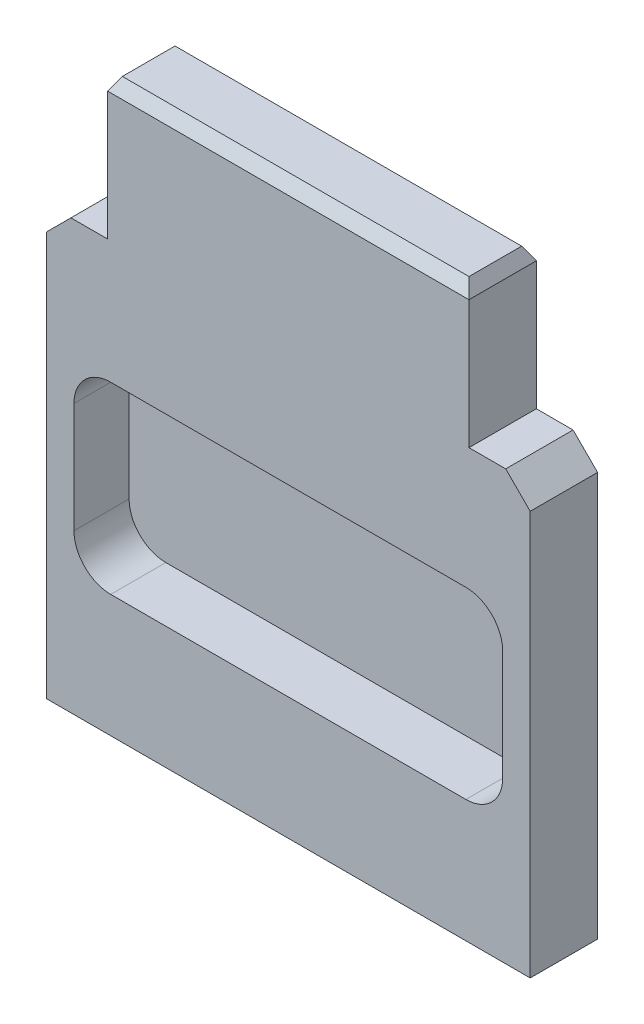
from build123d import *

# Parameters (mm, degrees)
EXTRUDE_1_DEPTH     = 5.5
CHAMFER_1_SIZE      = 0.6
CHAMFER_1_SIZE2     = 1.039230485
SKETCH_2_W          = 35
SKETCH_2_H          = 15
CUT_EXTRUDE_1_DEPTH = 4.5
FILLET_1_R          = 3
SKETCH_3_R          = 1
EXTRUDE_2_DEPTH     = 1.5


with BuildPart() as part:
    # Эскиз1 → Бобышка-Вытянуть1 (new body)
    with BuildSketch(Plane.XY):
        Polygon((19.75, 0), (-19.75, 0), (-19.75, 33), (-17.75, 35), (-14.75, 35), (-14.75, 46.5), (14.75, 46.5), (14.75, 35), (17.75, 35), (19.75, 33), align=None)
    extrude(amount=EXTRUDE_1_DEPTH)

    # Фаска1
    chamfer_1_edges = [part.edges().sort_by_distance(p)[0] for p in [
        (0, 46.5, 0),
        (-14.75, 46.5, 2.75),
        (14.75, 46.5, 2.75),
        (0, 46.5, 5.5),
    ]]
    chamfer_1_side = [part.faces().sort_by_distance(p)[0] for p in [
        (0, 46.5, 2.75),
    ]]
    chamfer(chamfer_1_edges, length=CHAMFER_1_SIZE, length2=CHAMFER_1_SIZE2, reference=chamfer_1_side[0])

    # Эскиз2 → Вырез-Вытянуть1 (cut)
    with BuildSketch(Plane.XY.offset(5.5)):
        with Locations((0, 17.5)):
            Rectangle(SKETCH_2_W, SKETCH_2_H)
    extrude(amount=-CUT_EXTRUDE_1_DEPTH, mode=Mode.SUBTRACT)

    # Скругление1
    fillet_1_edges = [part.edges().sort_by_distance(p)[0] for p in [
        (17.5, 10, 3.25),
        (17.5, 25, 3.25),
        (-17.5, 25, 3.25),
        (-17.5, 10, 3.25),
    ]]
    fillet(fillet_1_edges, radius=FILLET_1_R)

    # Эскиз3 → Бобышка-Вытянуть2 (add)
    with BuildSketch(Plane.XZ):
        with Locations(Location((0, 2.5, 0), (0, 0, 90))):
            Circle(SKETCH_3_R)
    extrude(amount=EXTRUDE_2_DEPTH)


solid = part.part
